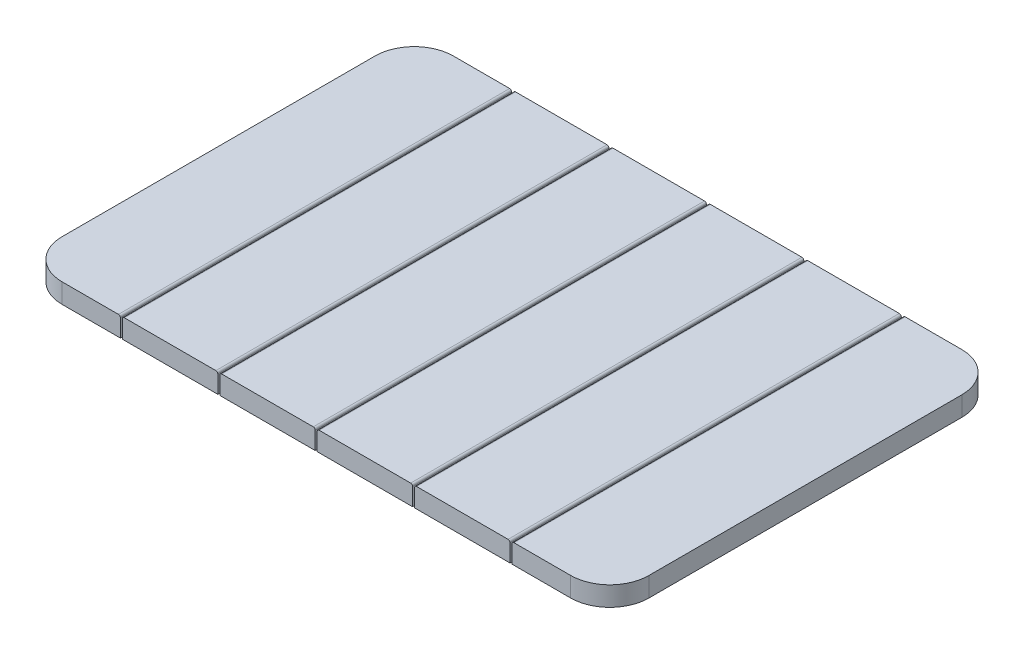
from build123d import *

# Parameters (mm, degrees)
SALIENTE_EXTRUIR3_DEPTH   = 50
CROQUIS1_W                = 244
CROQUIS1_H                = 1000
SALIENTE_EXTRUIR3_2_DEPTH = 50
SALIENTE_EXTRUIR3_3_DEPTH = 50
SALIENTE_EXTRUIR3_4_DEPTH = 50
SALIENTE_EXTRUIR3_5_DEPTH = 50
SALIENTE_EXTRUIR3_6_DEPTH = 50
REDONDEO1_R               = 5
REDONDEO2_R               = 5
REDONDEO3_R               = 5
REDONDEO4_R               = 5
REDONDEO5_R               = 5
REDONDEO6_R               = 5


with BuildPart() as part:
    # Croquis1 → Saliente-Extruir3 (new body)
    with BuildSketch(Plane(origin=(0, 0, 0), x_dir=(1, 0, 0), z_dir=(0, 1, 0))):
        with BuildLine():
            ThreePointArc((-650, -500), (-720.710678119, -470.710678119), (-750, -400))
            Line((-750, -400), (-750, 400))
            ThreePointArc((-750, 400), (-720.710678119, 470.710678119), (-650, 500))
            Line((-650, 500), (-501, 500))
            Line((-501, 500), (-501, -500))
            Line((-501, -500), (-650, -500))
        make_face()
    extrude(amount=SALIENTE_EXTRUIR3_DEPTH)

    # Redondeo1
    redondeo1_edges = [part.edges().sort_by_distance(p)[0] for p in [
        (-501, 50, 0),
    ]]
    fillet(redondeo1_edges, radius=REDONDEO1_R)


with BuildPart() as body_2:
    # Croquis1 → Saliente-Extruir3 2 (new body)
    with BuildSketch(Plane(origin=(0, 0, 0), x_dir=(1, 0, 0), z_dir=(0, 1, 0))):
        with Locations((-374, 0)):
            Rectangle(CROQUIS1_W, CROQUIS1_H)
    extrude(amount=SALIENTE_EXTRUIR3_2_DEPTH)

    # Redondeo2
    redondeo2_edges = [body_2.edges().sort_by_distance(p)[0] for p in [
        (-496, 50, 0),
        (-252, 50, 0),
    ]]
    fillet(redondeo2_edges, radius=REDONDEO2_R)


with BuildPart() as body_3:
    # Croquis1 → Saliente-Extruir3 3 (new body)
    with BuildSketch(Plane(origin=(0, 0, 0), x_dir=(1, 0, 0), z_dir=(0, 1, 0))):
        with Locations((-125, 0)):
            Rectangle(CROQUIS1_W, CROQUIS1_H)
    extrude(amount=SALIENTE_EXTRUIR3_3_DEPTH)

    # Redondeo3
    redondeo3_edges = [body_3.edges().sort_by_distance(p)[0] for p in [
        (-247, 50, 0),
        (-3, 50, 0),
    ]]
    fillet(redondeo3_edges, radius=REDONDEO3_R)


with BuildPart() as body_4:
    # Croquis1 → Saliente-Extruir3 4 (new body)
    with BuildSketch(Plane(origin=(0, 0, 0), x_dir=(1, 0, 0), z_dir=(0, 1, 0))):
        with Locations((124, 0)):
            Rectangle(CROQUIS1_W, CROQUIS1_H)
    extrude(amount=SALIENTE_EXTRUIR3_4_DEPTH)

    # Redondeo4
    redondeo4_edges = [body_4.edges().sort_by_distance(p)[0] for p in [
        (2, 50, 0),
        (246, 50, 0),
    ]]
    fillet(redondeo4_edges, radius=REDONDEO4_R)


with BuildPart() as body_5:
    # Croquis1 → Saliente-Extruir3 5 (new body)
    with BuildSketch(Plane(origin=(0, 0, 0), x_dir=(1, 0, 0), z_dir=(0, 1, 0))):
        with Locations((373, 0)):
            Rectangle(CROQUIS1_W, CROQUIS1_H)
    extrude(amount=SALIENTE_EXTRUIR3_5_DEPTH)

    # Redondeo5
    redondeo5_edges = [body_5.edges().sort_by_distance(p)[0] for p in [
        (251, 50, 0),
        (495, 50, 0),
    ]]
    fillet(redondeo5_edges, radius=REDONDEO5_R)


with BuildPart() as body_6:
    # Croquis1 → Saliente-Extruir3 6 (new body)
    with BuildSketch(Plane(origin=(0, 0, 0), x_dir=(1, 0, 0), z_dir=(0, 1, 0))):
        with BuildLine():
            Line((500, -500), (650, -500))
            ThreePointArc((650, -500), (720.710678119, -470.710678119), (750, -400))
            Line((750, -400), (750, 400))
            ThreePointArc((750, 400), (720.710678119, 470.710678119), (650, 500))
            Line((650, 500), (500, 500))
            Line((500, 500), (500, -500))
        make_face()
    extrude(amount=SALIENTE_EXTRUIR3_6_DEPTH)

    # Redondeo6
    redondeo6_edges = [body_6.edges().sort_by_distance(p)[0] for p in [
        (500, 50, 0),
    ]]
    fillet(redondeo6_edges, radius=REDONDEO6_R)


solid = Compound([part.part, body_2.part, body_3.part, body_4.part, body_5.part, body_6.part])
